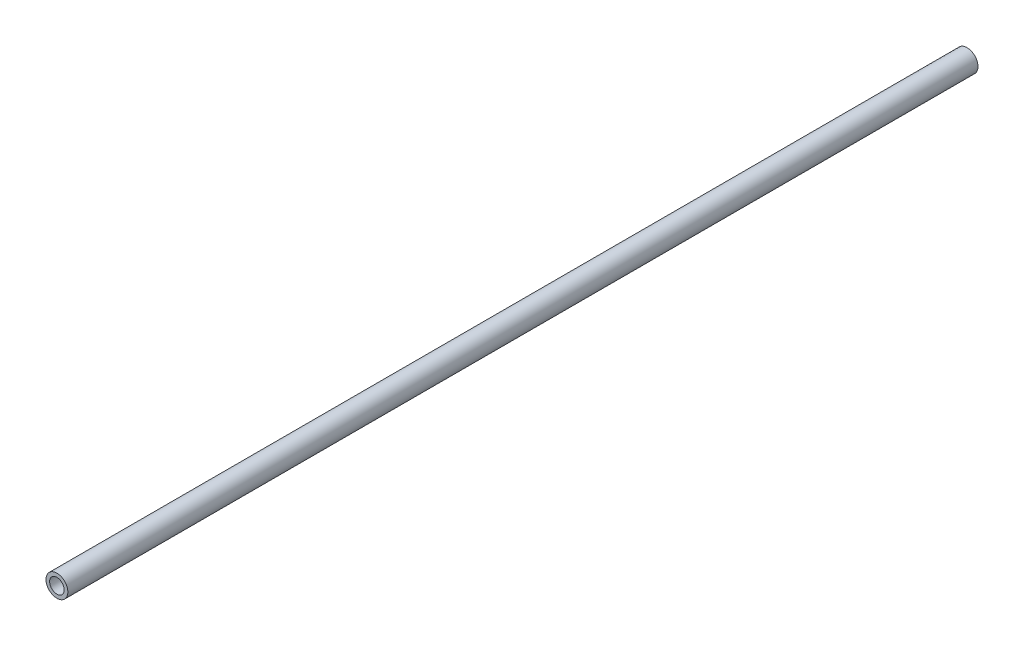
from build123d import *

# Parameters (mm, degrees)
SKETCH1_R           = 6
SKETCH1_R_2         = 4
EXTRUDE_THIN1_DEPTH = 250


with BuildPart() as part:
    # Sketch1 → Extrude-Thin1 (new, symmetric)
    with BuildSketch(Plane.XY):
        Circle(SKETCH1_R)
        Circle(SKETCH1_R_2, mode=Mode.SUBTRACT)
    extrude(amount=EXTRUDE_THIN1_DEPTH, both=True)


solid = part.part
